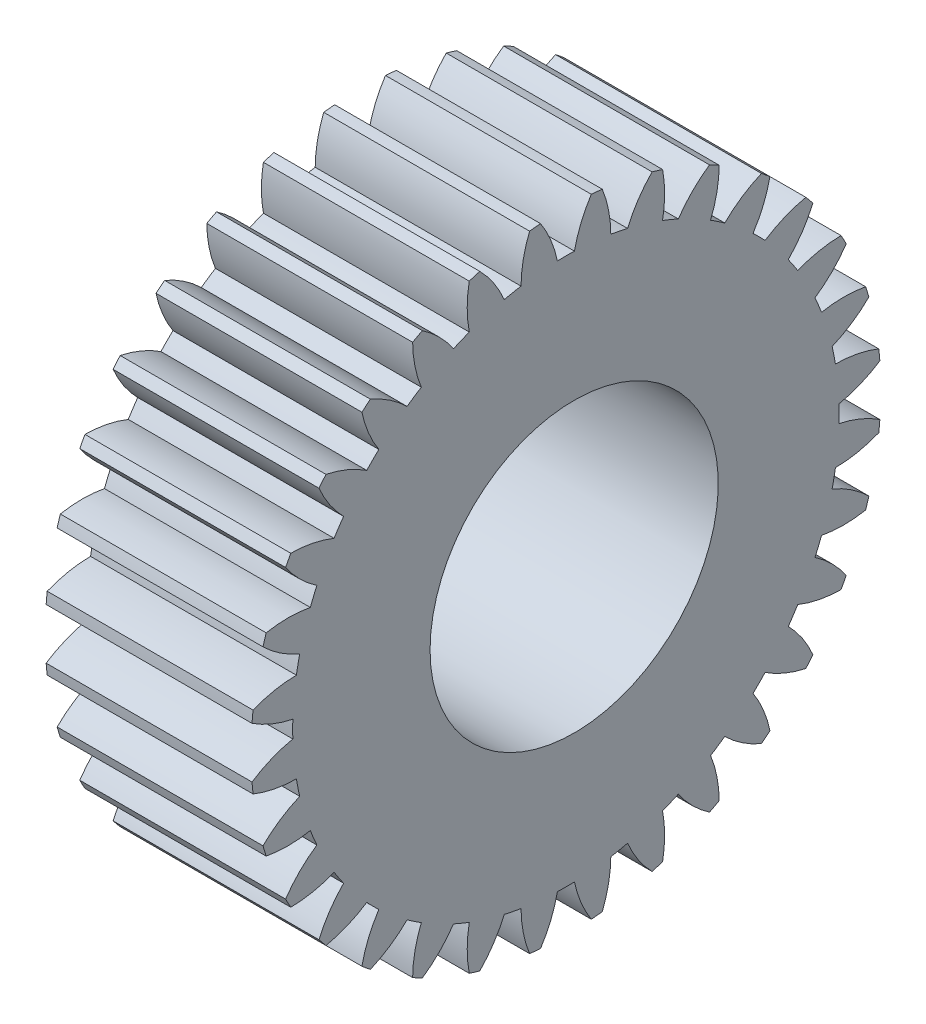
from build123d import *

# Parameters (mm, degrees)
BASPROSKE_W        = 10
BASPROSKE_H        = 15.3
TOOTHCUT_DEPTH     = 24.836526593
TEETHCUTS_COUNT    = 32
TEETHCUTS_ANGLE    = 348.75
BORSKE_R           = 0.4
BORE_DEPTH         = 50.0000508
SKETCH1_R          = 7
CUT_EXTRUDE1_DEPTH = 10


with BuildPart() as part:
    # BasProSke → Base-Revolve (revolve)
    with BuildSketch(Plane(origin=(0, 0, 0), x_dir=(1, 0, 0), z_dir=(0, 1, 0)), mode=Mode.PRIVATE) as base_revolve_sk:
        with Locations((5, 7.65)):
            Rectangle(BASPROSKE_W, BASPROSKE_H)
    revolve(base_revolve_sk.sketch.rotate(Axis((-10, 0, 0), (1, 0, 0)), 180), axis=Axis((-10, 0, 0), (1, 0, 0)))

    # TooCutSke → ToothCut (cut, through all)
    with BuildSketch(Plane(origin=(0, 0, 0), x_dir=(0, 0, -1), z_dir=(1, 0, 0))):
        with BuildLine():
            ThreePointArc((0.415489851, 13.267495777), (0, 13.274), (-0.415489851, 13.267495777))
            ThreePointArc((-0.415489851, 13.267495777), (-0.73687525, 14.310625213), (-1.24927321, 15.274396931))
            ThreePointArc((-1.24927321, 15.274396931), (0, 15.3254), (1.24927321, 15.274396931))
            ThreePointArc((1.24927321, 15.274396931), (0.73687525, 14.310625213), (0.415489851, 13.267495777))
        make_face()
    toothcut = extrude(amount=TOOTHCUT_DEPTH, mode=Mode.SUBTRACT)

    # TeethCuts: ToothCut ×32 about axis
    teethcuts_axis = Axis((-10, 0, 0), (1, 0, 0))
    for i in range(1, TEETHCUTS_COUNT):
        add(toothcut.rotate(teethcuts_axis, i * TEETHCUTS_ANGLE / (TEETHCUTS_COUNT - 1)), mode=Mode.SUBTRACT)

    # BorSke → Bore (cut, symmetric)
    with BuildSketch(Plane(origin=(0, 0, 0), x_dir=(0, 0, -1), z_dir=(1, 0, 0))):
        with Locations(Location((0, 0, 0), (0, 0, 180))):
            Circle(BORSKE_R)
    extrude(amount=BORE_DEPTH, both=True, mode=Mode.SUBTRACT)

    # Sketch1 → Cut-Extrude1 (cut)
    with BuildSketch(Plane.ZY):
        with Locations((-0.4, 0)):
            Circle(SKETCH1_R)
    extrude(amount=-CUT_EXTRUDE1_DEPTH, mode=Mode.SUBTRACT)


solid = part.part
